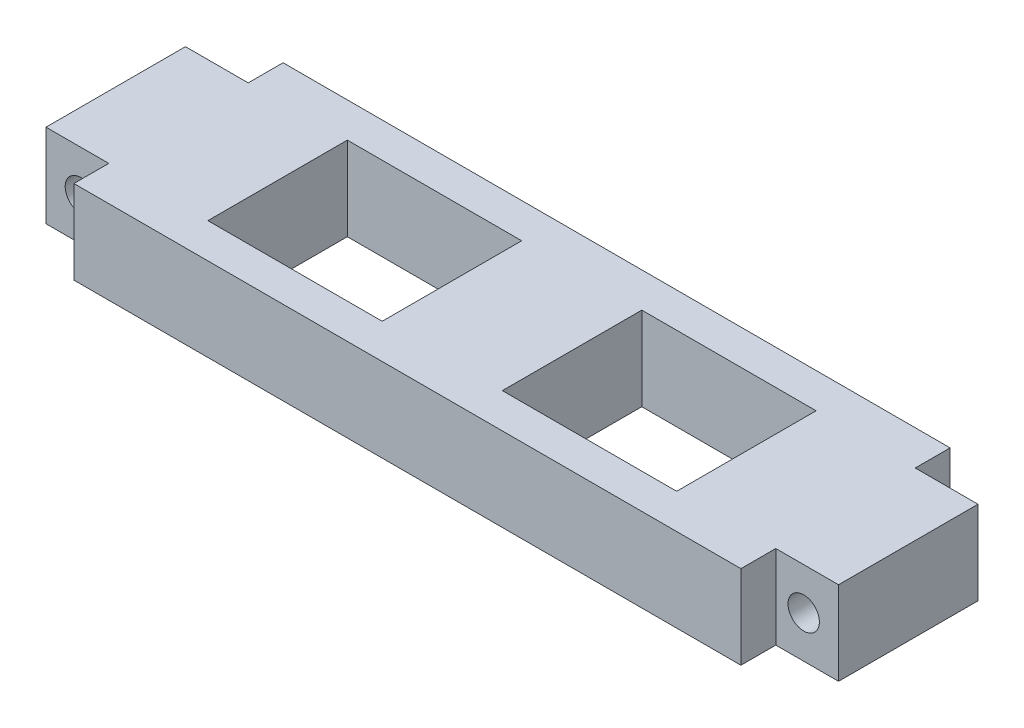
from build123d import *

# Parameters (mm, degrees)
SKETCH1_W           = 25
SKETCH1_H           = 20
BOSS_EXTRUDE1_DEPTH = 12
SKETCH2_R           = 2.25
CUT_EXTRUDE1_DEPTH  = 64.237868143


with BuildPart() as part:
    # Sketch1 → Boss-Extrude1 (new body)
    with BuildSketch(Plane(origin=(0, 0, 0), x_dir=(1, 0, 0), z_dir=(0, 1, 0))):
        Polygon((-47.833335, 15), (47.833335, 15), (47.833335, 10), (56.833335, 10), (56.833335, -10), (47.833335, -10), (47.833335, -15), (-47.833335, -15), (-47.833335, -10), (-56.833335, -10), (-56.833335, 10), (-47.833335, 10), align=None)
        with Locations((-21.115289313, 0)):
            Rectangle(SKETCH1_W, SKETCH1_H, mode=Mode.SUBTRACT)
        with Locations((21.115289313, 0)):
            Rectangle(SKETCH1_W, SKETCH1_H, mode=Mode.SUBTRACT)
    extrude(amount=BOSS_EXTRUDE1_DEPTH)

    # Sketch2 → Cut-Extrude1 (cut, through all)
    with BuildSketch(Plane(origin=(0, 0, -10), x_dir=(-1, 0, 0), z_dir=(0, 0, -1))):
        with Locations((-51.833335, 6)):
            Circle(SKETCH2_R)
        with Locations((51.833335, 6)):
            Circle(SKETCH2_R)
    extrude(amount=-CUT_EXTRUDE1_DEPTH, mode=Mode.SUBTRACT)


solid = part.part
